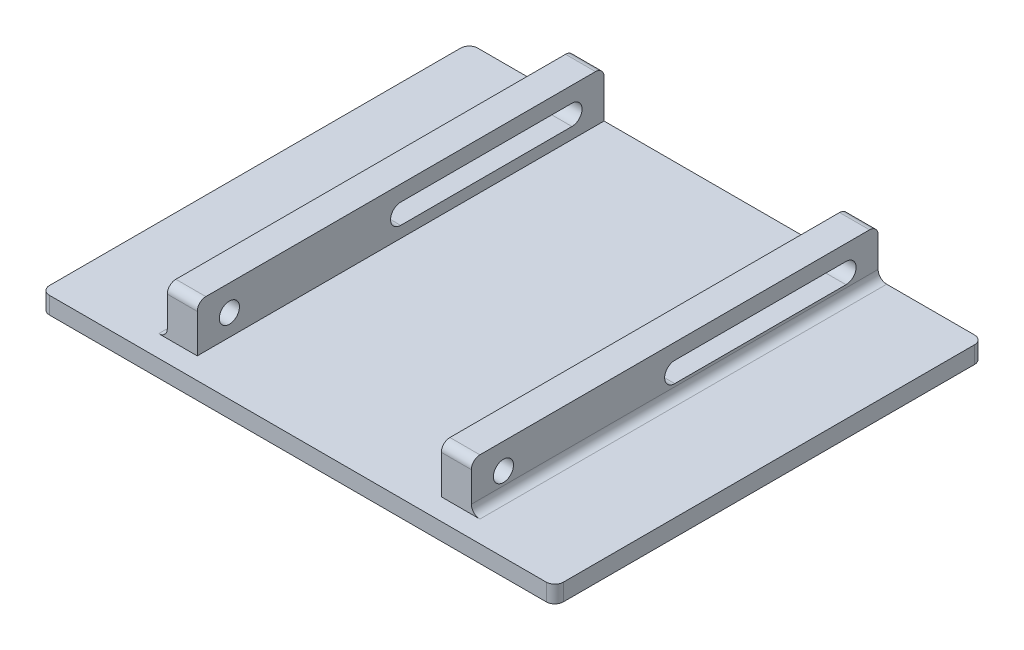
from build123d import *

# Parameters (mm, degrees)
SKETCH_1_W          = 120
SKETCH_1_H          = 135
EXTRUDE_1_DEPTH     = 4
SKETCH_2_W          = 7
SKETCH_2_H          = 95
EXTRUDE_2_DEPTH     = 11
SKETCH_4_R          = 2.35
CUT_EXTRUDE_2_DEPTH = 118.904622471
SKETCH_5_W          = 120
SKETCH_5_H          = 35
CUT_EXTRUDE_3_DEPTH = 10
FILLET_1_R          = 2


with BuildPart() as part:
    # 草图1 → 凸台-拉伸1 (new body)
    with BuildSketch(Plane(origin=(0, 0, 0), x_dir=(1, 0, 0), z_dir=(0, 1, 0))):
        Rectangle(SKETCH_1_W, SKETCH_1_H)
    extrude(amount=EXTRUDE_1_DEPTH)

    # 草图2 → 凸台-拉伸2 (add)
    with BuildSketch(Plane(origin=(0, 4, 0), x_dir=(1, 0, 0), z_dir=(0, 1, 0))):
        with Locations((-32, 20)):
            Rectangle(SKETCH_2_W, SKETCH_2_H)
        with Locations((32, 20)):
            Rectangle(SKETCH_2_W, SKETCH_2_H)
    extrude(amount=EXTRUDE_2_DEPTH)

    # 草图4 → 切除-拉伸2 (cut, through all)
    with BuildSketch(Plane.ZY.offset(35.5)):
        with Locations((20, 9)):
            Circle(SKETCH_4_R)
        with BuildLine():
            Line((-60, 11.35), (-20, 11.35))
            ThreePointArc((-20, 11.35), (-17.65, 9), (-20, 6.65))
            Line((-20, 6.65), (-60, 6.65))
            ThreePointArc((-60, 6.65), (-62.35, 9), (-60, 11.35))
        make_face()
    extrude(amount=-CUT_EXTRUDE_2_DEPTH, mode=Mode.SUBTRACT)

    # 草图5 → 切除-拉伸3 (cut)
    with BuildSketch(Plane(origin=(0, 4, 0), x_dir=(1, 0, 0), z_dir=(0, 1, 0))):
        with Locations((0, -50)):
            Rectangle(SKETCH_5_W, SKETCH_5_H)
    extrude(amount=-CUT_EXTRUDE_3_DEPTH, mode=Mode.SUBTRACT)

    # 圆角1
    fillet_1_edges = [part.edges().sort_by_distance(p)[0] for p in [
        (-35.5, 4, -20),
        (-32, 15, -67.5),
        (-32, 15, 27.5),
        (35.5, 4, -20),
        (32, 15, -67.5),
        (32, 15, 27.5),
        (-60, 2, -67.5),
        (60, 2, -67.5),
        (60, 2, 32.5),
        (-60, 2, 32.5),
    ]]
    fillet(fillet_1_edges, radius=FILLET_1_R)


solid = part.part
